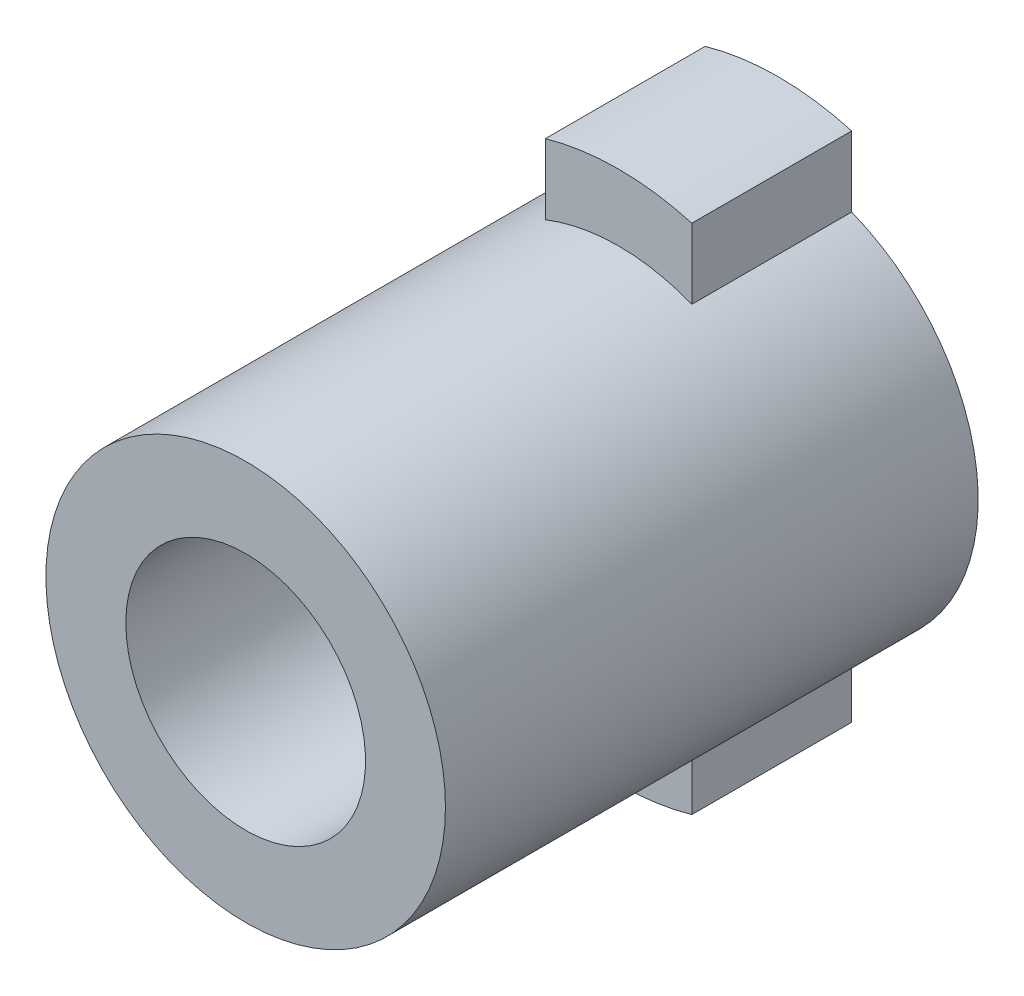
from build123d import *

# Parameters (mm, degrees)
SKETCH1_R           = 7.5
BOSS_EXTRUDE1_DEPTH = 20
BOSS_EXTRUDE2_DEPTH = 6
SKETCH3_R           = 4.5
CUT_EXTRUDE1_DEPTH  = 24.58495283


with BuildPart() as part:
    # Sketch1 → Boss-Extrude1 (new body)
    with BuildSketch(Plane.XY):
        Circle(SKETCH1_R)
    extrude(amount=BOSS_EXTRUDE1_DEPTH)

    # Sketch2 → Boss-Extrude2 (add)
    with BuildSketch(Plane(origin=(0, 0, 0), x_dir=(-1, 0, 0), z_dir=(0, 0, -1))):
        with BuildLine():
            Line((2.75, -9.614442262), (2.75, 9.614442262))
            ThreePointArc((2.75, 9.614442262), (0, 10), (-2.75, 9.614442262))
            Line((-2.75, 9.614442262), (-2.75, -9.614442262))
            ThreePointArc((-2.75, -9.614442262), (0, -10), (2.75, -9.614442262))
        make_face()
    extrude(amount=-BOSS_EXTRUDE2_DEPTH)

    # Sketch3 → Cut-Extrude1 (cut, through all)
    with BuildSketch(Plane(origin=(0, 0, 0), x_dir=(-1, 0, 0), z_dir=(0, 0, -1))):
        Circle(SKETCH3_R)
    extrude(amount=-CUT_EXTRUDE1_DEPTH, mode=Mode.SUBTRACT)


solid = part.part
